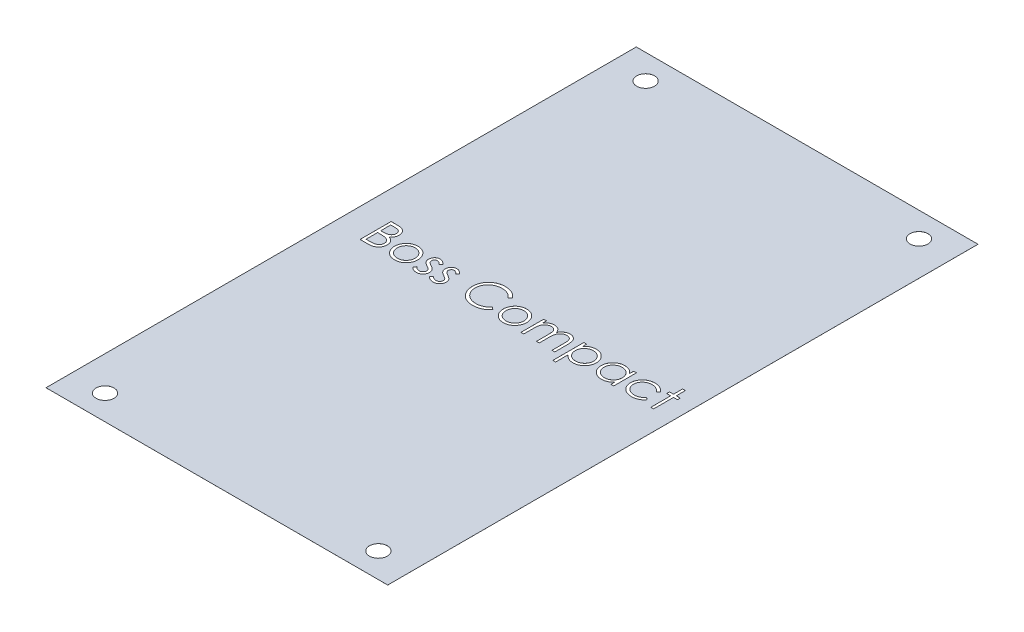
from build123d import *

# Parameters (mm, degrees)
SKETCH2_W           = 69.85
SKETCH2_H           = 120.65
BOSS_EXTRUDE1_DEPTH = 0.00254
SKETCH3_R           = 1.8288
CUT_EXTRUDE1_DEPTH  = 70.705532467
CUT_EXTRUDE2_DEPTH  = 2.54


with BuildPart() as part:
    # Sketch2 → Boss-Extrude1 (new body)
    with BuildSketch(Plane(origin=(0, 0, 0), x_dir=(1, 0, 0), z_dir=(0, 1, 0))):
        Rectangle(SKETCH2_W, SKETCH2_H)
    extrude(amount=BOSS_EXTRUDE1_DEPTH)

    # Sketch3 → Cut-Extrude1 (cut, through all)
    with BuildSketch(Plane(origin=(0, 0.00254, 0), x_dir=(1, 0, 0), z_dir=(0, 1, 0))):
        with Locations(Location((-27.94, 55.245, 0), (0, 0, 270))):
            Circle(SKETCH3_R)
        with Locations(Location((27.94, 55.245, 0), (0, 0, 270))):
            Circle(SKETCH3_R)
        with Locations(Location((27.94, -55.245, 0), (0, 0, 270))):
            Circle(SKETCH3_R)
        with Locations(Location((-27.94, -55.245, 0), (0, 0, 270))):
            Circle(SKETCH3_R)
    extrude(amount=-CUT_EXTRUDE1_DEPTH, mode=Mode.SUBTRACT)

    # Sketch5 → Cut-Extrude2 (cut)
    # profile 1 of 11: a face of its own
    with BuildSketch(Plane(origin=(0, 0.00254, 0), x_dir=(1, 0, 0), z_dir=(0, 1, 0))):
        with BuildLine():
            Line((-29.079721619, 4.369281251), (-27.840759279, 4.369281251))
            add(Edge.make_bspline(
                [(-27.840759279, 4.369281251), (-27.780110469, 4.36896239), (-27.66255798, 4.368344357), (-27.491616993, 4.358759248), (-27.331508436, 4.345689732), (-27.182185878, 4.324952278), (-27.043718318, 4.299930054), (-26.915688462, 4.269628188), (-26.798503435, 4.233294189), (-26.658598899, 4.175515936), (-26.4990857, 4.089658187), (-26.326368616, 3.962787791), (-26.178678067, 3.807607465), (-26.051340035, 3.632560361), (-25.95010086, 3.439999747), (-25.876859421, 3.234515219), (-25.830490133, 3.018757201), (-25.825721402, 2.87063315), (-25.823311363, 2.795773639)],
                knots=[0, 0, 0, 0, 1.001505555, 1.941167018, 2.826882275, 3.653841531, 4.429895133, 5.150066043, 5.825578002, 6.45369114, 7.647487171, 8.808567382, 9.977351308, 11.170798116, 12.373658725, 13.556498008, 14.765093433, 16, 16, 16, 16], degree=3))
            add(Edge.make_bspline(
                [(-25.823311363, 2.795773639), (-25.825294773, 2.725646859), (-25.829192362, 2.587841124), (-25.866462797, 2.386284669), (-25.924811438, 2.194421743), (-26.005919533, 2.012952558), (-26.111333155, 1.845977289), (-26.236261819, 1.692148963), (-26.386986875, 1.557980617), (-26.499913896, 1.482972779), (-26.557275706, 1.444872197)],
                knots=[0, 0, 0, 0, 1.044552857, 2.05264487, 3.044412934, 4.028983338, 5.005914585, 5.980388656, 6.974128949, 8, 8, 8, 8], degree=3))
            add(Edge.make_bspline(
                [(-26.557275706, 1.444872197), (-26.48513893, 1.417177127), (-26.347123408, 1.364189599), (-26.157193071, 1.270508114), (-25.993553852, 1.168613999), (-25.854947602, 1.0573405), (-25.736406428, 0.937400229), (-25.632896091, 0.807034522), (-25.544574169, 0.664542775), (-25.468895008, 0.511410647), (-25.409842265, 0.349201768), (-25.36561741, 0.179437646), (-25.340276466, 0.002727025), (-25.336670317, -0.117533592), (-25.334849824, -0.17824479)],
                knots=[0, 0, 0, 0, 1.27268992, 2.434971085, 3.483601985, 4.442670788, 5.356604649, 6.2567628, 7.179492994, 8.113709626, 9.066344395, 10.018646069, 10.999752585, 12, 12, 12, 12], degree=3))
            add(Edge.make_bspline(
                [(-25.334849824, -0.17824479), (-25.336622102, -0.240233258), (-25.340109108, -0.362197306), (-25.365835628, -0.541367336), (-25.409395008, -0.712590453), (-25.469395517, -0.876974142), (-25.547704287, -1.034200386), (-25.643005023, -1.184447307), (-25.756636574, -1.326205307), (-25.883750636, -1.461049595), (-26.027554814, -1.582294295), (-26.182704827, -1.690272791), (-26.351154579, -1.779074932), (-26.530137482, -1.853671143), (-26.721661313, -1.910652774), (-26.924866043, -1.950517301), (-27.139576419, -1.977377868), (-27.286914111, -1.979586226), (-27.362474023, -1.980718749)],
                knots=[0, 0, 0, 0, 0.978564426, 1.925352924, 2.850884081, 3.763762016, 4.682927383, 5.618979971, 6.567305752, 7.547517671, 8.540179244, 9.531824382, 10.526200242, 11.540722885, 12.589160233, 13.674978461, 14.80764778, 16, 16, 16, 16], degree=3))
            Line((-27.362474023, -1.980718749), (-29.079721619, -1.980718749))
            Line((-29.079721619, -1.980718749), (-29.079721619, 4.369281251))
        make_face()
        with BuildLine():
            Line((-28.509849824, 3.7179992), (-28.509849824, 1.68274279))
            Line((-28.509849824, 1.68274279), (-28.126967212, 1.68274279))
            add(Edge.make_bspline(
                [(-28.126967212, 1.68274279), (-28.070998683, 1.683468364), (-27.96285608, 1.684870322), (-27.806247125, 1.688886275), (-27.660877449, 1.700131296), (-27.52699798, 1.711373086), (-27.404819546, 1.729651267), (-27.294612826, 1.751408404), (-27.194648229, 1.774418817), (-27.079369339, 1.813552029), (-26.948608418, 1.87138724), (-26.809211215, 1.961143285), (-26.686321535, 2.068048898), (-26.582549494, 2.191403928), (-26.497620112, 2.32723258), (-26.438630943, 2.473367634), (-26.39863087, 2.626167017), (-26.395017663, 2.731065847), (-26.393183157, 2.784325322)],
                knots=[0, 0, 0, 0, 1.156816544, 2.235205308, 3.236616184, 4.169592532, 5.011045266, 5.787822928, 6.49130361, 7.128639758, 8.301311294, 9.436451833, 10.541879658, 11.654887649, 12.756523258, 13.837046038, 14.901820046, 16, 16, 16, 16], degree=3))
            add(Edge.make_bspline(
                [(-26.393183157, 2.784325322), (-26.394137799, 2.819569222), (-26.396010432, 2.888703979), (-26.411347138, 2.989486379), (-26.437414023, 3.084271473), (-26.470895383, 3.174358216), (-26.517683433, 3.256929716), (-26.572771431, 3.334840942), (-26.639329754, 3.405438643), (-26.71508945, 3.471423304), (-26.802190809, 3.52992409), (-26.900581867, 3.581160903), (-27.011593795, 3.62241917), (-27.133355689, 3.658552761), (-27.267741805, 3.683931522), (-27.413201352, 3.705074097), (-27.570925771, 3.715837786), (-27.680046171, 3.717262659), (-27.736452388, 3.7179992)],
                knots=[0, 0, 0, 0, 0.91205012, 1.789085906, 2.630437955, 3.453916878, 4.269457761, 5.079663411, 5.91843418, 6.774407191, 7.675494373, 8.627863946, 9.638891023, 10.736472738, 11.911756761, 13.175263542, 14.539845004, 16, 16, 16, 16], degree=3))
            Line((-27.736452388, 3.7179992), (-28.509849824, 3.7179992))
        make_face(mode=Mode.SUBTRACT)
        with BuildLine():
            Line((-28.509849824, 1.031460738), (-28.509849824, -1.329436697))
            Line((-28.509849824, -1.329436697), (-27.698291331, -1.329436697))
            add(Edge.make_bspline(
                [(-27.698291331, -1.329436697), (-27.640199851, -1.32874047), (-27.528236182, -1.327398583), (-27.366581093, -1.323017892), (-27.216751747, -1.313053334), (-27.079431844, -1.297367293), (-26.953138594, -1.280352106), (-26.839387047, -1.25747164), (-26.73725511, -1.231257097), (-26.618828866, -1.190736527), (-26.485472501, -1.127787216), (-26.341761376, -1.032874262), (-26.213988095, -0.919801975), (-26.105484267, -0.788935888), (-26.016560702, -0.646639052), (-25.951871519, -0.495789631), (-25.911973822, -0.338880175), (-25.907143887, -0.23189771), (-25.904721619, -0.17824479)],
                knots=[0, 0, 0, 0, 1.160039823, 2.235823828, 3.228722157, 4.157150951, 4.99529583, 5.772374946, 6.472645482, 7.099169577, 8.269452708, 9.405989375, 10.527446681, 11.663510218, 12.788923519, 13.866172445, 14.929861265, 16, 16, 16, 16], degree=3))
            add(Edge.make_bspline(
                [(-25.904721619, -0.17824479), (-25.905222551, -0.144692587), (-25.906216335, -0.07812938), (-25.921203451, 0.019689321), (-25.943000043, 0.114441976), (-25.971178502, 0.206385877), (-26.012216678, 0.293858717), (-26.060125695, 0.378590504), (-26.116298524, 0.460693245), (-26.203827225, 0.564492619), (-26.331139254, 0.684084914), (-26.512035832, 0.801174382), (-26.717725573, 0.895603975), (-26.866909739, 0.935698739), (-26.943974423, 0.956410658)],
                knots=[0, 0, 0, 0, 0.723448775, 1.435228256, 2.130040452, 2.821711965, 3.505591119, 4.210454504, 4.921174351, 5.648778258, 7.137944449, 8.670945889, 10.280296675, 12, 12, 12, 12], degree=3))
            add(Edge.make_bspline(
                [(-26.943974423, 0.956410658), (-26.974870069, 0.962679168), (-27.041858201, 0.976270589), (-27.151091954, 0.990617423), (-27.275798459, 1.003399174), (-27.416265679, 1.012853703), (-27.572671333, 1.022626432), (-27.745349457, 1.026427036), (-27.933594871, 1.030961408), (-28.064209604, 1.031290037), (-28.132055353, 1.031460738)],
                knots=[0, 0, 0, 0, 0.634451884, 1.375622551, 2.216452059, 3.157844607, 4.20941857, 5.370758133, 6.634282058, 8, 8, 8, 8], degree=3))
            Line((-28.132055353, 1.031460738), (-28.509849824, 1.031460738))
        make_face(mode=Mode.SUBTRACT)
    # profile 2 of 11: a face of its own
    with BuildSketch(Plane(origin=(0, 0.00254, 0), x_dir=(1, 0, 0), z_dir=(0, 1, 0))):
        with BuildLine():
            add(Edge.make_bspline(
                [(-21.953780113, 2.741076123), (-21.866710232, 2.739222121), (-21.695987475, 2.735586875), (-21.445964596, 2.696734008), (-21.207304135, 2.637320933), (-20.979092043, 2.555185385), (-20.76425105, 2.445090989), (-20.559651793, 2.313719846), (-20.36585522, 2.158085712), (-20.249699152, 2.037693217), (-20.190739247, 1.976582934)],
                knots=[0, 0, 0, 0, 1.054011418, 2.066658804, 3.057071809, 4.030435133, 4.997543892, 5.974964718, 6.972108034, 8, 8, 8, 8], degree=3))
            add(Edge.make_bspline(
                [(-20.190739247, 1.976582934), (-20.139971988, 1.91813756), (-20.039419955, 1.80237789), (-19.910486437, 1.61467985), (-19.799413035, 1.420297096), (-19.710398805, 1.216648374), (-19.64021312, 1.005511471), (-19.590382499, 0.786160679), (-19.560742631, 0.559080421), (-19.55674582, 0.404859172), (-19.554721619, 0.326753206)],
                knots=[0, 0, 0, 0, 1.025258237, 2.030674902, 3.01204498, 3.988269485, 4.97094183, 5.956517959, 6.965070386, 8, 8, 8, 8], degree=3))
            add(Edge.make_bspline(
                [(-19.554721619, 0.326753206), (-19.556502045, 0.24819453), (-19.560020251, 0.092958923), (-19.593300812, -0.135676212), (-19.645064353, -0.357372534), (-19.719144974, -0.571201878), (-19.814137544, -0.777817865), (-19.930053505, -0.976318047), (-20.067706296, -1.16709406), (-20.223742119, -1.348525967), (-20.39619338, -1.515741814), (-20.583275535, -1.661480246), (-20.781312139, -1.786342154), (-20.992936509, -1.886919651), (-21.216216092, -1.966221536), (-21.451632487, -2.021920137), (-21.698819972, -2.055596335), (-21.86759793, -2.059920818), (-21.953780113, -2.062129005)],
                knots=[0, 0, 0, 0, 0.998656419, 1.973391657, 2.932242238, 3.890759089, 4.846373663, 5.82037756, 6.809684879, 7.83454468, 8.860553229, 9.859544525, 10.845671541, 11.83227036, 12.833544569, 13.85385346, 14.904124723, 16, 16, 16, 16], degree=3))
            add(Edge.make_bspline(
                [(-21.953780113, -2.062129005), (-22.040384532, -2.059913406), (-22.210003663, -2.055574044), (-22.458063659, -2.022050974), (-22.693901968, -1.966247206), (-22.917473854, -1.88665904), (-23.130008076, -1.786338939), (-23.329192149, -1.661857731), (-23.516426282, -1.515698592), (-23.688914025, -1.348537678), (-23.844940066, -1.167091043), (-23.982595381, -0.97631883), (-24.098510687, -0.777817661), (-24.193503428, -0.571201932), (-24.267584003, -0.357372519), (-24.319347557, -0.135676216), (-24.352628115, 0.092958924), (-24.356146321, 0.248194531), (-24.357926747, 0.326753206)],
                knots=[0, 0, 0, 0, 1.099876186, 2.154163076, 3.173186993, 4.173200201, 5.163417411, 6.152872554, 7.150605724, 8.17532212, 9.198891216, 10.186952605, 11.159729845, 12.11414092, 13.071450619, 14.029093627, 15.002601286, 16, 16, 16, 16], degree=3))
            add(Edge.make_bspline(
                [(-24.357926747, 0.326753206), (-24.355888741, 0.404434654), (-24.35185384, 0.55823057), (-24.322243773, 0.784883951), (-24.272607535, 1.0038635), (-24.202337716, 1.214185435), (-24.112503012, 1.416941726), (-24.00299039, 1.611804777), (-23.872741671, 1.798654072), (-23.772589559, 1.914264131), (-23.721909119, 1.972766828)],
                knots=[0, 0, 0, 0, 1.031353054, 2.041901799, 3.029428768, 4.008703097, 4.981709435, 5.96992636, 6.972712378, 8, 8, 8, 8], degree=3))
            add(Edge.make_bspline(
                [(-23.721909119, 1.972766828), (-23.663038104, 2.034407075), (-23.547257894, 2.155633467), (-23.352496631, 2.310813903), (-23.148400698, 2.44491878), (-22.931185475, 2.552825628), (-22.703160861, 2.637804082), (-22.463277378, 2.696887231), (-22.212406086, 2.735446889), (-22.040847916, 2.739181012), (-21.953780113, 2.741076123)],
                knots=[0, 0, 0, 0, 1.027980169, 2.021703884, 2.998553061, 3.971491411, 4.943284454, 5.930300938, 6.949603206, 8, 8, 8, 8], degree=3))
        make_face()
        with BuildLine():
            add(Edge.make_bspline(
                [(-21.956324183, 2.171204328), (-22.017896706, 2.169454283), (-22.139452268, 2.165999371), (-22.318376372, 2.139721429), (-22.490624937, 2.0980881), (-22.656524754, 2.038935027), (-22.815516367, 1.962555596), (-22.967751997, 1.868741857), (-23.113679424, 1.75873635), (-23.250444025, 1.632711217), (-23.375960505, 1.495045041), (-23.485684834, 1.348363019), (-23.57898467, 1.195044362), (-23.656708958, 1.034929636), (-23.714597714, 0.866396257), (-23.756640198, 0.691352826), (-23.782893348, 0.509442713), (-23.786315778, 0.385779151), (-23.788054952, 0.322937101)],
                knots=[0, 0, 0, 0, 1.021534396, 2.016698045, 2.994645724, 3.958388632, 4.93408049, 5.916473867, 6.921342795, 7.962252576, 8.998418191, 10.008913653, 10.997312074, 11.973003931, 12.956656626, 13.948281152, 14.957379055, 16, 16, 16, 16], degree=3))
            add(Edge.make_bspline(
                [(-23.788054952, 0.322937101), (-23.785139715, 0.241744137), (-23.779353515, 0.080591287), (-23.732299586, -0.156737464), (-23.653584478, -0.384578824), (-23.547290413, -0.601597125), (-23.414110559, -0.802388258), (-23.25719831, -0.981406522), (-23.07823771, -1.135957923), (-22.87936206, -1.264193171), (-22.664633512, -1.366083014), (-22.437382758, -1.438289727), (-22.200363213, -1.485228369), (-22.038382458, -1.489893758), (-21.956324183, -1.49225721)],
                knots=[0, 0, 0, 0, 1.016792936, 2.018143844, 3.017858371, 4.030088057, 5.03801393, 6.028138512, 7.003788237, 7.991172063, 8.984598303, 9.972568034, 10.972917682, 12, 12, 12, 12], degree=3))
            add(Edge.make_bspline(
                [(-21.956324183, -1.49225721), (-21.874270628, -1.489879988), (-21.71229919, -1.485187416), (-21.475608969, -1.438526129), (-21.248979334, -1.36576663), (-21.034473817, -1.264307763), (-20.835688693, -1.135470954), (-20.655441002, -0.982279241), (-20.499868522, -0.801914111), (-20.36682041, -0.601331166), (-20.258785605, -0.38491527), (-20.180438939, -0.156695413), (-20.13327189, 0.080580578), (-20.127500958, 0.241740549), (-20.124593414, 0.322937101)],
                knots=[0, 0, 0, 0, 1.02726834, 2.027799167, 3.010890988, 4.004497153, 4.992059811, 5.971914811, 6.958719428, 7.966827853, 8.981595046, 9.981490638, 10.983022906, 12, 12, 12, 12], degree=3))
            add(Edge.make_bspline(
                [(-20.124593414, 0.322937101), (-20.126331989, 0.385779527), (-20.129753241, 0.509443828), (-20.156014962, 0.691348565), (-20.198025727, 0.86641189), (-20.256031375, 1.034871953), (-20.333417943, 1.195458925), (-20.428516982, 1.347912859), (-20.537793271, 1.495553164), (-20.664824333, 1.632266198), (-20.801446176, 1.758785478), (-20.947432745, 1.868784513), (-21.099442635, 1.962143294), (-21.257972349, 2.03958833), (-21.423893436, 2.097549933), (-21.595900656, 2.139961822), (-21.774061354, 2.165888322), (-21.895181333, 2.169420993), (-21.956324183, 2.171204328)],
                knots=[0, 0, 0, 0, 1.042956736, 2.052379634, 3.044323526, 4.02829302, 5.004299113, 5.996692471, 7.007513377, 8.048758398, 9.090003419, 10.095195979, 11.07790575, 12.047570684, 13.018257071, 13.989683339, 14.985167495, 16, 16, 16, 16], degree=3))
        make_face(mode=Mode.SUBTRACT)
    # profile 3 of 11: a face of its own
    with BuildSketch(Plane(origin=(0, 0.00254, 0), x_dir=(1, 0, 0), z_dir=(0, 1, 0))):
        with BuildLine():
            Line((-16.216901106, 2.080889825), (-16.603599824, 1.68274279))
            add(Edge.make_bspline(
                [(-16.603599824, 1.68274279), (-16.636965452, 1.721410927), (-16.701290454, 1.795958542), (-16.803310427, 1.895630077), (-16.904953251, 1.979335667), (-17.004827527, 2.050006193), (-17.105444672, 2.103435359), (-17.205623938, 2.14243318), (-17.305469049, 2.166566456), (-17.372209427, 2.169676938), (-17.404982036, 2.171204328)],
                knots=[0, 0, 0, 0, 1.26578478, 2.440284043, 3.530471711, 4.527705817, 5.468200915, 6.346673037, 7.188140097, 8, 8, 8, 8], degree=3))
            add(Edge.make_bspline(
                [(-17.404982036, 2.171204328), (-17.445149214, 2.169254201), (-17.524192537, 2.165416628), (-17.637450808, 2.127110833), (-17.742589799, 2.068312122), (-17.833588891, 1.984911977), (-17.910673682, 1.889182518), (-17.966941361, 1.782146329), (-18.001351074, 1.66703345), (-18.005713945, 1.587150708), (-18.007926747, 1.546635017)],
                knots=[0, 0, 0, 0, 0.99966794, 1.967205029, 2.953328237, 3.988086729, 5.028030931, 6.008226631, 6.989793394, 8, 8, 8, 8], degree=3))
            add(Edge.make_bspline(
                [(-18.007926747, 1.546635017), (-18.005911416, 1.509964594), (-18.001886436, 1.436727122), (-17.970596032, 1.328689975), (-17.92076473, 1.22335792), (-17.874191663, 1.158836647), (-17.850194375, 1.125591347)],
                knots=[0, 0, 0, 0, 0.960159726, 1.917612774, 2.927026955, 4, 4, 4, 4], degree=3))
            add(Edge.make_bspline(
                [(-17.850194375, 1.125591347), (-17.835746322, 1.107839316), (-17.804995463, 1.070056354), (-17.747285728, 1.017616506), (-17.681930616, 0.959664136), (-17.603335872, 0.901721589), (-17.514887578, 0.84070403), (-17.414667734, 0.779014446), (-17.305856847, 0.711950418), (-17.227956305, 0.669415514), (-17.187464007, 0.647306091)],
                knots=[0, 0, 0, 0, 0.66740084, 1.420478572, 2.27185888, 3.217733974, 4.268547843, 5.408967954, 6.65319498, 8, 8, 8, 8], degree=3))
            add(Edge.make_bspline(
                [(-17.187464007, 0.647306091), (-17.138090803, 0.619647482), (-17.04271803, 0.566220156), (-16.907204009, 0.483289694), (-16.784218949, 0.40086411), (-16.672720809, 0.319824913), (-16.574854956, 0.23790471), (-16.487652125, 0.158243494), (-16.413287377, 0.07843432), (-16.371642395, 0.022675671), (-16.351736843, -0.00397596)],
                knots=[0, 0, 0, 0, 1.27191281, 2.456916733, 3.569705269, 4.599008579, 5.553216877, 6.436649441, 7.252746552, 8, 8, 8, 8], degree=3))
            add(Edge.make_bspline(
                [(-16.351736843, -0.00397596), (-16.318697744, -0.05779872), (-16.252943803, -0.164916001), (-16.183895234, -0.341298005), (-16.143871593, -0.528369917), (-16.13831585, -0.656335516), (-16.13549085, -0.721403845)],
                knots=[0, 0, 0, 0, 0.995354457, 1.980940102, 2.973342416, 4, 4, 4, 4], degree=3))
            add(Edge.make_bspline(
                [(-16.13549085, -0.721403845), (-16.13679629, -0.767249296), (-16.139368802, -0.857592765), (-16.157254152, -0.990643099), (-16.188015323, -1.117887225), (-16.229913991, -1.240705813), (-16.286491353, -1.356745604), (-16.352799499, -1.468934227), (-16.432401125, -1.574844844), (-16.523281192, -1.674338386), (-16.622786588, -1.765208242), (-16.728933439, -1.845080273), (-16.841852461, -1.91143657), (-16.9607368, -1.966346554), (-17.085856573, -2.01001325), (-17.21723134, -2.040243843), (-17.354443509, -2.058337281), (-17.447751876, -2.060849116), (-17.495296539, -2.062129005)],
                knots=[0, 0, 0, 0, 1.032770009, 2.035186124, 3.017557409, 3.978232242, 4.952395191, 5.920591857, 6.910227898, 7.931268572, 8.952309245, 9.941945286, 10.918353717, 11.897095711, 12.887975737, 13.898235213, 14.929059601, 16, 16, 16, 16], degree=3))
            add(Edge.make_bspline(
                [(-17.495296539, -2.062129005), (-17.5594627, -2.060327963), (-17.686903439, -2.056750904), (-17.875389072, -2.023175622), (-18.059576734, -1.97093255), (-18.238072586, -1.898876498), (-18.406884821, -1.807888776), (-18.561336642, -1.698918434), (-18.701964581, -1.575565153), (-18.782007734, -1.481017443), (-18.822029311, -1.433743588)],
                knots=[0, 0, 0, 0, 1.013940152, 2.01379169, 3.017749504, 4.037548394, 5.051665909, 6.043208538, 7.021604269, 8, 8, 8, 8], degree=3))
            Line((-18.822029311, -1.433743588), (-18.44423484, -1.003795672))
            add(Edge.make_bspline(
                [(-18.44423484, -1.003795672), (-18.408362034, -1.042539316), (-18.338817174, -1.117649729), (-18.227599253, -1.217661032), (-18.114425196, -1.301483339), (-18.000425122, -1.371593534), (-17.883911522, -1.425614623), (-17.765537337, -1.463566929), (-17.645543339, -1.487958534), (-17.564948892, -1.49082199), (-17.52455335, -1.49225721)],
                knots=[0, 0, 0, 0, 1.179806542, 2.287233372, 3.337373186, 4.324005949, 5.273901747, 6.200048787, 7.097828587, 8, 8, 8, 8], degree=3))
            add(Edge.make_bspline(
                [(-17.52455335, -1.49225721), (-17.46954797, -1.489770142), (-17.362076684, -1.484910829), (-17.208145865, -1.440792676), (-17.066017214, -1.371614049), (-16.94260343, -1.273488954), (-16.837552367, -1.159269558), (-16.761482679, -1.030611084), (-16.713810189, -0.891289441), (-16.708211306, -0.794710835), (-16.705362645, -0.745572515)],
                knots=[0, 0, 0, 0, 1.072336372, 2.095165389, 3.102688358, 4.141489647, 5.156069229, 6.117746104, 7.042326257, 8, 8, 8, 8], degree=3))
            add(Edge.make_bspline(
                [(-16.705362645, -0.745572515), (-16.707333493, -0.705096492), (-16.711224669, -0.625182004), (-16.741783177, -0.509520671), (-16.790066495, -0.399812119), (-16.837609214, -0.335605188), (-16.861822981, -0.302904246)],
                knots=[0, 0, 0, 0, 1.013901739, 2.00181326, 2.98231254, 4, 4, 4, 4], degree=3))
            add(Edge.make_bspline(
                [(-16.861822981, -0.302904246), (-16.876377897, -0.286511517), (-16.90808376, -0.250802234), (-16.966241126, -0.199231019), (-17.03587679, -0.143644754), (-17.117773943, -0.084986014), (-17.212097681, -0.024028544), (-17.319230301, 0.038907852), (-17.43770416, 0.10681244), (-17.521470877, 0.151842386), (-17.565258478, 0.175381011)],
                knots=[0, 0, 0, 0, 0.615000592, 1.339693406, 2.178160186, 3.116406724, 4.166410947, 5.330106347, 6.604359322, 8, 8, 8, 8], degree=3))
            add(Edge.make_bspline(
                [(-17.565258478, 0.175381011), (-17.612514525, 0.20175915), (-17.704159081, 0.252914779), (-17.833966309, 0.332591096), (-17.951073652, 0.413630295), (-18.05829898, 0.491486446), (-18.152933947, 0.570264444), (-18.234605739, 0.650051743), (-18.306529859, 0.727630575), (-18.346348735, 0.782598528), (-18.365368654, 0.808854569)],
                knots=[0, 0, 0, 0, 1.262093308, 2.447601706, 3.550203992, 4.582594899, 5.537233252, 6.418365656, 7.244515135, 8, 8, 8, 8], degree=3))
            add(Edge.make_bspline(
                [(-18.365368654, 0.808854569), (-18.398262742, 0.861733042), (-18.464062413, 0.967508466), (-18.527952831, 1.144057474), (-18.571869484, 1.329922078), (-18.575792677, 1.458168228), (-18.577798542, 1.523738383)],
                knots=[0, 0, 0, 0, 0.985009483, 1.970363186, 2.962279964, 4, 4, 4, 4], degree=3))
            add(Edge.make_bspline(
                [(-18.577798542, 1.523738383), (-18.576829359, 1.566601605), (-18.574932531, 1.650491003), (-18.559794037, 1.773751434), (-18.532231933, 1.890860227), (-18.497660859, 2.003576107), (-18.449613122, 2.109715621), (-18.392198408, 2.210694175), (-18.324729795, 2.306372198), (-18.246999824, 2.395277881), (-18.161534911, 2.476030516), (-18.069197257, 2.546422312), (-17.972063563, 2.606486699), (-17.869722573, 2.656860633), (-17.761191144, 2.694963141), (-17.6472279, 2.721192968), (-17.528063519, 2.738710265), (-17.446600047, 2.740276146), (-17.404982036, 2.741076123)],
                knots=[0, 0, 0, 0, 1.087655834, 2.128696564, 3.144119009, 4.137814668, 5.115653402, 6.093965665, 7.082169637, 8.081268856, 9.086088321, 10.061021666, 11.022561449, 11.980240094, 12.950172527, 13.934149372, 14.944599409, 16, 16, 16, 16], degree=3))
            add(Edge.make_bspline(
                [(-17.404982036, 2.741076123), (-17.355647863, 2.739072533), (-17.256054061, 2.735027769), (-17.106639239, 2.702904588), (-16.957444462, 2.650048813), (-16.808086384, 2.57704879), (-16.659659144, 2.482584601), (-16.510857133, 2.368412872), (-16.359893992, 2.235284733), (-16.265630396, 2.133504709), (-16.216901106, 2.080889825)],
                knots=[0, 0, 0, 0, 0.845714091, 1.707292901, 2.609013841, 3.555613372, 4.552488639, 5.621697636, 6.770543573, 8, 8, 8, 8], degree=3))
        make_face()
    # profile 4 of 11: a face of its own
    with BuildSketch(Plane(origin=(0, 0.00254, 0), x_dir=(1, 0, 0), z_dir=(0, 1, 0))):
        with BuildLine():
            Line((-12.797670337, 2.080889825), (-13.184369055, 1.68274279))
            add(Edge.make_bspline(
                [(-13.184369055, 1.68274279), (-13.217734683, 1.721410927), (-13.282059685, 1.795958542), (-13.384079658, 1.895630077), (-13.485722482, 1.979335667), (-13.585596758, 2.050006193), (-13.686213903, 2.103435359), (-13.786393169, 2.14243318), (-13.88623828, 2.166566456), (-13.952978658, 2.169676938), (-13.985751266, 2.171204328)],
                knots=[0, 0, 0, 0, 1.26578478, 2.440284043, 3.530471711, 4.527705817, 5.468200915, 6.346673037, 7.188140097, 8, 8, 8, 8], degree=3))
            add(Edge.make_bspline(
                [(-13.985751266, 2.171204328), (-14.025918445, 2.169254201), (-14.104961768, 2.165416628), (-14.218220039, 2.127110833), (-14.32335903, 2.068312122), (-14.414358122, 1.984911977), (-14.491442913, 1.889182518), (-14.547710591, 1.782146329), (-14.582120304, 1.66703345), (-14.586483175, 1.587150708), (-14.588695978, 1.546635017)],
                knots=[0, 0, 0, 0, 0.99966794, 1.967205029, 2.953328237, 3.988086729, 5.028030931, 6.008226631, 6.989793394, 8, 8, 8, 8], degree=3))
            add(Edge.make_bspline(
                [(-14.588695978, 1.546635017), (-14.586680647, 1.509964594), (-14.582655667, 1.436727122), (-14.551365263, 1.328689975), (-14.501533961, 1.22335792), (-14.454960894, 1.158836647), (-14.430963606, 1.125591347)],
                knots=[0, 0, 0, 0, 0.960159726, 1.917612774, 2.927026955, 4, 4, 4, 4], degree=3))
            add(Edge.make_bspline(
                [(-14.430963606, 1.125591347), (-14.416515553, 1.107839316), (-14.385764693, 1.070056354), (-14.328054959, 1.017616506), (-14.262699847, 0.959664136), (-14.184105103, 0.901721589), (-14.095656809, 0.84070403), (-13.995436965, 0.779014446), (-13.886626077, 0.711950418), (-13.808725535, 0.669415514), (-13.768233238, 0.647306091)],
                knots=[0, 0, 0, 0, 0.66740084, 1.420478572, 2.27185888, 3.217733974, 4.268547843, 5.408967954, 6.65319498, 8, 8, 8, 8], degree=3))
            add(Edge.make_bspline(
                [(-13.768233238, 0.647306091), (-13.718860033, 0.619647482), (-13.623487261, 0.566220156), (-13.48797324, 0.483289694), (-13.36498818, 0.40086411), (-13.25349004, 0.319824913), (-13.155624187, 0.23790471), (-13.068421356, 0.158243494), (-12.994056607, 0.07843432), (-12.952411626, 0.022675671), (-12.932506074, -0.00397596)],
                knots=[0, 0, 0, 0, 1.27191281, 2.456916733, 3.569705269, 4.599008579, 5.553216877, 6.436649441, 7.252746552, 8, 8, 8, 8], degree=3))
            add(Edge.make_bspline(
                [(-12.932506074, -0.00397596), (-12.899466974, -0.05779872), (-12.833713034, -0.164916001), (-12.764664465, -0.341298005), (-12.724640823, -0.528369917), (-12.719085081, -0.656335516), (-12.716260081, -0.721403845)],
                knots=[0, 0, 0, 0, 0.995354457, 1.980940102, 2.973342416, 4, 4, 4, 4], degree=3))
            add(Edge.make_bspline(
                [(-12.716260081, -0.721403845), (-12.71756552, -0.767249296), (-12.720138032, -0.857592765), (-12.738023382, -0.990643099), (-12.768784554, -1.117887225), (-12.810683222, -1.240705813), (-12.867260584, -1.356745604), (-12.93356873, -1.468934227), (-13.013170356, -1.574844844), (-13.104050423, -1.674338386), (-13.203555819, -1.765208242), (-13.30970267, -1.845080273), (-13.422621691, -1.91143657), (-13.541506031, -1.966346554), (-13.666625804, -2.01001325), (-13.798000571, -2.040243843), (-13.93521274, -2.058337281), (-14.028521106, -2.060849116), (-14.07606577, -2.062129005)],
                knots=[0, 0, 0, 0, 1.032770009, 2.035186124, 3.017557409, 3.978232242, 4.952395191, 5.920591857, 6.910227898, 7.931268572, 8.952309245, 9.941945286, 10.918353717, 11.897095711, 12.887975737, 13.898235213, 14.929059601, 16, 16, 16, 16], degree=3))
            add(Edge.make_bspline(
                [(-14.07606577, -2.062129005), (-14.140231931, -2.060327963), (-14.26767267, -2.056750904), (-14.456158303, -2.023175622), (-14.640345965, -1.97093255), (-14.818841817, -1.898876498), (-14.987654052, -1.807888776), (-15.142105872, -1.698918434), (-15.282733811, -1.575565153), (-15.362776965, -1.481017443), (-15.402798542, -1.433743588)],
                knots=[0, 0, 0, 0, 1.013940152, 2.01379169, 3.017749504, 4.037548394, 5.051665909, 6.043208538, 7.021604269, 8, 8, 8, 8], degree=3))
            Line((-15.402798542, -1.433743588), (-15.025004071, -1.003795672))
            add(Edge.make_bspline(
                [(-15.025004071, -1.003795672), (-14.989131265, -1.042539316), (-14.919586405, -1.117649729), (-14.808368483, -1.217661032), (-14.695194427, -1.301483339), (-14.581194353, -1.371593534), (-14.464680753, -1.425614623), (-14.346306567, -1.463566929), (-14.226312569, -1.487958534), (-14.145718123, -1.49082199), (-14.105322581, -1.49225721)],
                knots=[0, 0, 0, 0, 1.179806542, 2.287233372, 3.337373186, 4.324005949, 5.273901747, 6.200048787, 7.097828587, 8, 8, 8, 8], degree=3))
            add(Edge.make_bspline(
                [(-14.105322581, -1.49225721), (-14.050317201, -1.489770142), (-13.942845915, -1.484910829), (-13.788915096, -1.440792676), (-13.646786445, -1.371614049), (-13.523372661, -1.273488954), (-13.418321597, -1.159269558), (-13.34225191, -1.030611084), (-13.29457942, -0.891289441), (-13.288980537, -0.794710835), (-13.286131875, -0.745572515)],
                knots=[0, 0, 0, 0, 1.072336372, 2.095165389, 3.102688358, 4.141489647, 5.156069229, 6.117746104, 7.042326257, 8, 8, 8, 8], degree=3))
            add(Edge.make_bspline(
                [(-13.286131875, -0.745572515), (-13.288102724, -0.705096492), (-13.2919939, -0.625182004), (-13.322552408, -0.509520671), (-13.370835725, -0.399812119), (-13.418378444, -0.335605188), (-13.442592212, -0.302904246)],
                knots=[0, 0, 0, 0, 1.013901739, 2.00181326, 2.98231254, 4, 4, 4, 4], degree=3))
            add(Edge.make_bspline(
                [(-13.442592212, -0.302904246), (-13.457147128, -0.286511517), (-13.48885299, -0.250802234), (-13.547010357, -0.199231019), (-13.616646021, -0.143644754), (-13.698543174, -0.084986014), (-13.792866912, -0.024028544), (-13.899999531, 0.038907852), (-14.018473391, 0.10681244), (-14.102240108, 0.151842386), (-14.146027709, 0.175381011)],
                knots=[0, 0, 0, 0, 0.615000592, 1.339693406, 2.178160186, 3.116406724, 4.166410947, 5.330106347, 6.604359322, 8, 8, 8, 8], degree=3))
            add(Edge.make_bspline(
                [(-14.146027709, 0.175381011), (-14.193283756, 0.20175915), (-14.284928312, 0.252914779), (-14.41473554, 0.332591096), (-14.531842882, 0.413630295), (-14.63906821, 0.491486446), (-14.733703178, 0.570264444), (-14.81537497, 0.650051743), (-14.88729909, 0.727630575), (-14.927117966, 0.782598528), (-14.946137885, 0.808854569)],
                knots=[0, 0, 0, 0, 1.262093308, 2.447601706, 3.550203992, 4.582594899, 5.537233252, 6.418365656, 7.244515135, 8, 8, 8, 8], degree=3))
            add(Edge.make_bspline(
                [(-14.946137885, 0.808854569), (-14.979031973, 0.861733042), (-15.044831644, 0.967508466), (-15.108722062, 1.144057474), (-15.152638715, 1.329922078), (-15.156561908, 1.458168228), (-15.158567773, 1.523738383)],
                knots=[0, 0, 0, 0, 0.985009483, 1.970363186, 2.962279964, 4, 4, 4, 4], degree=3))
            add(Edge.make_bspline(
                [(-15.158567773, 1.523738383), (-15.15759859, 1.566601605), (-15.155701762, 1.650491003), (-15.140563268, 1.773751434), (-15.113001163, 1.890860227), (-15.07843009, 2.003576107), (-15.030382353, 2.109715621), (-14.972967639, 2.210694175), (-14.905499025, 2.306372198), (-14.827769055, 2.395277881), (-14.742304141, 2.476030516), (-14.649966488, 2.546422312), (-14.552832794, 2.606486699), (-14.450491804, 2.656860633), (-14.341960374, 2.694963141), (-14.227997131, 2.721192968), (-14.10883275, 2.738710265), (-14.027369278, 2.740276146), (-13.985751266, 2.741076123)],
                knots=[0, 0, 0, 0, 1.087655834, 2.128696564, 3.144119009, 4.137814668, 5.115653402, 6.093965665, 7.082169637, 8.081268856, 9.086088321, 10.061021666, 11.022561449, 11.980240094, 12.950172527, 13.934149372, 14.944599409, 16, 16, 16, 16], degree=3))
            add(Edge.make_bspline(
                [(-13.985751266, 2.741076123), (-13.936417094, 2.739072533), (-13.836823292, 2.735027769), (-13.68740847, 2.702904588), (-13.538213692, 2.650048813), (-13.388855615, 2.57704879), (-13.240428375, 2.482584601), (-13.091626364, 2.368412872), (-12.940663223, 2.235284733), (-12.846399627, 2.133504709), (-12.797670337, 2.080889825)],
                knots=[0, 0, 0, 0, 0.845714091, 1.707292901, 2.609013841, 3.555613372, 4.552488639, 5.621697636, 6.770543573, 8, 8, 8, 8], degree=3))
        make_face()
    # profile 5 of 11: a face of its own
    with BuildSketch(Plane(origin=(0, 0.00254, 0), x_dir=(1, 0, 0), z_dir=(0, 1, 0))):
        with BuildLine():
            Line((-3.109849824, 3.204096956), (-3.608487645, 2.822486379))
            add(Edge.make_bspline(
                [(-3.608487645, 2.822486379), (-3.644058328, 2.864878925), (-3.714720124, 2.949092472), (-3.82840182, 3.067346788), (-3.946877658, 3.17813662), (-4.070102349, 3.281989744), (-4.200293895, 3.375274448), (-4.334298487, 3.46285202), (-4.474357797, 3.541352059), (-4.668035944, 3.636534905), (-4.92139704, 3.735860072), (-5.240339106, 3.819141649), (-5.57328067, 3.872157211), (-5.800424886, 3.877899137), (-5.9159596, 3.880819713)],
                knots=[0, 0, 0, 0, 0.757959112, 1.505699292, 2.245454638, 2.979532153, 3.711538275, 4.438200793, 5.171680507, 5.909471876, 7.393775596, 8.890124382, 10.418191784, 12, 12, 12, 12], degree=3))
            add(Edge.make_bspline(
                [(-5.9159596, 3.880819713), (-5.979610729, 3.880086809), (-6.106322244, 3.878627805), (-6.294370188, 3.85937982), (-6.478906724, 3.832326625), (-6.659811813, 3.792184967), (-6.83685518, 3.741434644), (-7.011194253, 3.680791393), (-7.180304912, 3.605761898), (-7.346526573, 3.522834055), (-7.505783142, 3.429167119), (-7.656468728, 3.326998609), (-7.798033756, 3.21747182), (-7.930590209, 3.100176241), (-8.054273601, 2.975640113), (-8.168187722, 2.842536236), (-8.271938395, 2.70129015), (-8.367582141, 2.553764396), (-8.453239528, 2.400388689), (-8.524958024, 2.240595347), (-8.588467317, 2.07712076), (-8.638721657, 1.908117939), (-8.678498995, 1.734776064), (-8.705944898, 1.55662992), (-8.724973982, 1.374051673), (-8.726425731, 1.250300491), (-8.727157516, 1.187921075)],
                knots=[0, 0, 0, 0, 1.054917814, 2.100044995, 3.131103042, 4.146048494, 5.169673617, 6.183595914, 7.203665975, 8.234915748, 9.262203917, 10.264457458, 11.251630812, 12.227803204, 13.197192746, 14.159520551, 15.12972552, 16.100847026, 17.073214652, 18.039054194, 19.002613845, 19.979014051, 20.95965708, 21.949030935, 22.966165397, 24, 24, 24, 24], degree=3))
            add(Edge.make_bspline(
                [(-8.727157516, 1.187921075), (-8.724868216, 1.09406568), (-8.720373479, 0.909793062), (-8.680371501, 0.639880669), (-8.619583693, 0.381307446), (-8.528478289, 0.135689732), (-8.41613944, -0.100001146), (-8.274188616, -0.321777351), (-8.109784327, -0.532990261), (-7.920600738, -0.728648181), (-7.7130359, -0.907380225), (-7.490336117, -1.064770566), (-7.253056053, -1.195970424), (-7.003815595, -1.305146784), (-6.740696788, -1.389069704), (-6.46417279, -1.448150329), (-6.174845027, -1.486689713), (-5.977143401, -1.490379404), (-5.876526507, -1.49225721)],
                knots=[0, 0, 0, 0, 1.029171465, 2.020641659, 2.987623507, 3.938342917, 4.889210282, 5.84687017, 6.821220943, 7.821438502, 8.827599549, 9.822697543, 10.807740252, 11.797342354, 12.80366471, 13.83203677, 14.896651826, 16, 16, 16, 16], degree=3))
            add(Edge.make_bspline(
                [(-5.876526507, -1.49225721), (-5.765668771, -1.489193281), (-5.547474228, -1.483162736), (-5.227492237, -1.432073813), (-4.921175919, -1.349237305), (-4.628508798, -1.233308217), (-4.35031594, -1.082604052), (-4.086161999, -0.899909331), (-3.835824007, -0.683486213), (-3.685290395, -0.518235395), (-3.608487645, -0.433923877)],
                knots=[0, 0, 0, 0, 1.028121516, 2.023589091, 2.998037872, 3.967518031, 4.937445131, 5.927275754, 6.942489185, 8, 8, 8, 8], degree=3))
            Line((-3.608487645, -0.433923877), (-3.109849824, -0.811718348))
            add(Edge.make_bspline(
                [(-3.109849824, -0.811718348), (-3.149978395, -0.863495254), (-3.230043323, -0.966801057), (-3.359688582, -1.112436873), (-3.496263108, -1.249422766), (-3.640781324, -1.376654307), (-3.791580746, -1.496677409), (-3.951369084, -1.60608216), (-4.118045758, -1.706395622), (-4.291046026, -1.798247327), (-4.470186081, -1.879740047), (-4.65525127, -1.949506169), (-4.845443886, -2.009604182), (-5.040772622, -2.059046982), (-5.241642638, -2.097638806), (-5.44732907, -2.123437358), (-5.658275844, -2.141111975), (-5.800590993, -2.142722908), (-5.872710401, -2.143539262)],
                knots=[0, 0, 0, 0, 0.986787822, 1.968848986, 2.935600012, 3.899624008, 4.868462664, 5.837806735, 6.815139263, 7.798259679, 8.787526145, 9.778297419, 10.776456485, 11.791383307, 12.812564526, 13.85620153, 14.913611965, 16, 16, 16, 16], degree=3))
            add(Edge.make_bspline(
                [(-5.872710401, -2.143539262), (-5.941006768, -2.143063932), (-6.076054378, -2.142124027), (-6.275442113, -2.126898238), (-6.469551781, -2.106125144), (-6.657828602, -2.07484662), (-6.841300014, -2.037936175), (-7.018302788, -1.988458323), (-7.19057867, -1.933033407), (-7.357435517, -1.867891502), (-7.519015258, -1.794383571), (-7.674796744, -1.7113046), (-7.824708329, -1.619353217), (-7.970223878, -1.52055627), (-8.10919378, -1.411740308), (-8.242822319, -1.294416556), (-8.371858811, -1.168980451), (-8.451692254, -1.078529503), (-8.491830994, -1.033052483)],
                knots=[0, 0, 0, 0, 1.114604814, 2.203992996, 3.262667896, 4.300477797, 5.318619304, 6.316056647, 7.298880507, 8.271930387, 9.238335007, 10.195173496, 11.151986948, 12.108099108, 13.064862484, 14.031167946, 15.010108607, 16, 16, 16, 16], degree=3))
            add(Edge.make_bspline(
                [(-8.491830994, -1.033052483), (-8.556121376, -0.954056326), (-8.683925969, -0.797017723), (-8.84743971, -0.542498871), (-8.987407417, -0.276763692), (-9.100575159, 0.001583893), (-9.189044689, 0.291919296), (-9.250333429, 0.594388872), (-9.290159911, 0.908710138), (-9.294714292, 1.122499741), (-9.297029311, 1.231170274)],
                knots=[0, 0, 0, 0, 0.994628077, 1.977248131, 2.950237994, 3.925870899, 4.908910175, 5.911660606, 6.938484602, 8, 8, 8, 8], degree=3))
            add(Edge.make_bspline(
                [(-9.297029311, 1.231170274), (-9.294207746, 1.345389454), (-9.288656492, 1.57010856), (-9.241492692, 1.899898446), (-9.165621447, 2.215858841), (-9.057858521, 2.517399921), (-8.921233098, 2.806107715), (-8.752456241, 3.079776758), (-8.553488712, 3.340157237), (-8.325890982, 3.583298286), (-8.07630453, 3.805619683), (-7.809026111, 4.001210939), (-7.524578864, 4.163984146), (-7.226096476, 4.300048612), (-6.911343883, 4.404632138), (-6.580992627, 4.477844348), (-6.235663453, 4.523413974), (-6.000055909, 4.529174708), (-5.880342613, 4.532101764)],
                knots=[0, 0, 0, 0, 1.032925535, 2.032216505, 3.007276963, 3.968222605, 4.92396291, 5.891752235, 6.871517503, 7.883894988, 8.900124299, 9.891468569, 10.874487609, 11.85992873, 12.854644235, 13.869047385, 14.917252991, 16, 16, 16, 16], degree=3))
            add(Edge.make_bspline(
                [(-5.880342613, 4.532101764), (-5.807382071, 4.531227028), (-5.662964026, 4.529495575), (-5.44932707, 4.512611574), (-5.241333134, 4.48446546), (-5.038838924, 4.446154876), (-4.84085932, 4.398607307), (-4.648907455, 4.336667052), (-4.46185698, 4.265843631), (-4.28088759, 4.184276128), (-4.106867563, 4.09271504), (-3.939851099, 3.992175266), (-3.781164856, 3.882781448), (-3.629692231, 3.765463972), (-3.487967105, 3.637740872), (-3.351965565, 3.503125233), (-3.226306181, 3.357739581), (-3.14873967, 3.255404915), (-3.109849824, 3.204096956)],
                knots=[0, 0, 0, 0, 1.096760587, 2.17092713, 3.219439832, 4.250915756, 5.268269357, 6.278326846, 7.281116186, 8.274029601, 9.260640565, 10.235837813, 11.203064059, 12.156899882, 13.114053108, 14.069676657, 15.032185724, 16, 16, 16, 16], degree=3))
        make_face()
    # profile 6 of 11: a face of its own
    with BuildSketch(Plane(origin=(0, 0.00254, 0), x_dir=(1, 0, 0), z_dir=(0, 1, 0))):
        with BuildLine():
            add(Edge.make_bspline(
                [(0.271219887, 2.741076123), (0.358289768, 2.739222121), (0.529012525, 2.735586875), (0.779035404, 2.696734008), (1.017695865, 2.637320933), (1.245907957, 2.555185385), (1.46074895, 2.445090989), (1.665348207, 2.313719846), (1.85914478, 2.158085712), (1.975300848, 2.037693217), (2.034260753, 1.976582934)],
                knots=[0, 0, 0, 0, 1.054011418, 2.066658804, 3.057071809, 4.030435133, 4.997543892, 5.974964718, 6.972108034, 8, 8, 8, 8], degree=3))
            add(Edge.make_bspline(
                [(2.034260753, 1.976582934), (2.085028012, 1.91813756), (2.185580045, 1.80237789), (2.314513563, 1.61467985), (2.425586965, 1.420297096), (2.514601195, 1.216648374), (2.58478688, 1.005511471), (2.634617501, 0.786160679), (2.664257369, 0.559080421), (2.66825418, 0.404859172), (2.670278381, 0.326753206)],
                knots=[0, 0, 0, 0, 1.025258237, 2.030674902, 3.01204498, 3.988269485, 4.97094183, 5.956517959, 6.965070386, 8, 8, 8, 8], degree=3))
            add(Edge.make_bspline(
                [(2.670278381, 0.326753206), (2.668497955, 0.24819453), (2.664979749, 0.092958923), (2.631699188, -0.135676212), (2.579935647, -0.357372534), (2.505855026, -0.571201878), (2.410862456, -0.777817865), (2.294946495, -0.976318047), (2.157293704, -1.16709406), (2.001257881, -1.348525967), (1.82880662, -1.515741814), (1.641724465, -1.661480246), (1.443687861, -1.786342154), (1.232063491, -1.886919651), (1.008783908, -1.966221536), (0.773367513, -2.021920137), (0.526180028, -2.055596335), (0.35740207, -2.059920818), (0.271219887, -2.062129005)],
                knots=[0, 0, 0, 0, 0.998656419, 1.973391657, 2.932242238, 3.890759089, 4.846373663, 5.82037756, 6.809684879, 7.83454468, 8.860553229, 9.859544525, 10.845671541, 11.83227036, 12.833544569, 13.85385346, 14.904124723, 16, 16, 16, 16], degree=3))
            add(Edge.make_bspline(
                [(0.271219887, -2.062129005), (0.184615468, -2.059913406), (0.014996337, -2.055574044), (-0.233063659, -2.022050974), (-0.468901968, -1.966247206), (-0.692473854, -1.88665904), (-0.905008076, -1.786338939), (-1.104192149, -1.661857731), (-1.291426282, -1.515698592), (-1.463914025, -1.348537678), (-1.619940066, -1.167091043), (-1.757595381, -0.97631883), (-1.873510687, -0.777817661), (-1.968503428, -0.571201932), (-2.042584003, -0.357372519), (-2.094347557, -0.135676216), (-2.127628115, 0.092958924), (-2.131146321, 0.248194531), (-2.132926747, 0.326753206)],
                knots=[0, 0, 0, 0, 1.099876186, 2.154163076, 3.173186993, 4.173200201, 5.163417411, 6.152872554, 7.150605724, 8.17532212, 9.198891216, 10.186952605, 11.159729845, 12.11414092, 13.071450619, 14.029093627, 15.002601286, 16, 16, 16, 16], degree=3))
            add(Edge.make_bspline(
                [(-2.132926747, 0.326753206), (-2.130888741, 0.404434654), (-2.12685384, 0.55823057), (-2.097243773, 0.784883951), (-2.047607535, 1.0038635), (-1.977337716, 1.214185435), (-1.887503012, 1.416941726), (-1.77799039, 1.611804777), (-1.647741671, 1.798654072), (-1.547589559, 1.914264131), (-1.496909119, 1.972766828)],
                knots=[0, 0, 0, 0, 1.031353054, 2.041901799, 3.029428768, 4.008703097, 4.981709435, 5.96992636, 6.972712378, 8, 8, 8, 8], degree=3))
            add(Edge.make_bspline(
                [(-1.496909119, 1.972766828), (-1.438038104, 2.034407075), (-1.322257894, 2.155633467), (-1.127496631, 2.310813903), (-0.923400698, 2.44491878), (-0.706185475, 2.552825628), (-0.478160861, 2.637804082), (-0.238277378, 2.696887231), (0.012593914, 2.735446889), (0.184152084, 2.739181012), (0.271219887, 2.741076123)],
                knots=[0, 0, 0, 0, 1.027980169, 2.021703884, 2.998553061, 3.971491411, 4.943284454, 5.930300938, 6.949603206, 8, 8, 8, 8], degree=3))
        make_face()
        with BuildLine():
            add(Edge.make_bspline(
                [(0.268675817, 2.171204328), (0.207103294, 2.169454283), (0.085547732, 2.165999371), (-0.093376372, 2.139721429), (-0.265624937, 2.0980881), (-0.431524754, 2.038935027), (-0.590516367, 1.962555596), (-0.742751997, 1.868741857), (-0.888679424, 1.75873635), (-1.025444025, 1.632711217), (-1.150960505, 1.495045041), (-1.260684834, 1.348363019), (-1.35398467, 1.195044362), (-1.431708958, 1.034929636), (-1.489597714, 0.866396257), (-1.531640198, 0.691352826), (-1.557893348, 0.509442713), (-1.561315778, 0.385779151), (-1.563054952, 0.322937101)],
                knots=[0, 0, 0, 0, 1.021534396, 2.016698045, 2.994645724, 3.958388632, 4.93408049, 5.916473867, 6.921342795, 7.962252576, 8.998418191, 10.008913653, 10.997312074, 11.973003931, 12.956656626, 13.948281152, 14.957379055, 16, 16, 16, 16], degree=3))
            add(Edge.make_bspline(
                [(-1.563054952, 0.322937101), (-1.560139715, 0.241744137), (-1.554353515, 0.080591287), (-1.507299586, -0.156737464), (-1.428584478, -0.384578824), (-1.322290413, -0.601597125), (-1.189110559, -0.802388258), (-1.03219831, -0.981406522), (-0.85323771, -1.135957923), (-0.65436206, -1.264193171), (-0.439633512, -1.366083014), (-0.212382758, -1.438289727), (0.024636787, -1.485228369), (0.186617542, -1.489893758), (0.268675817, -1.49225721)],
                knots=[0, 0, 0, 0, 1.016792936, 2.018143844, 3.017858371, 4.030088057, 5.03801393, 6.028138512, 7.003788237, 7.991172063, 8.984598303, 9.972568034, 10.972917682, 12, 12, 12, 12], degree=3))
            add(Edge.make_bspline(
                [(0.268675817, -1.49225721), (0.350729372, -1.489879988), (0.51270081, -1.485187416), (0.749391031, -1.438526129), (0.976020666, -1.36576663), (1.190526183, -1.264307763), (1.389311307, -1.135470954), (1.569558998, -0.982279241), (1.725131478, -0.801914111), (1.85817959, -0.601331166), (1.966214395, -0.38491527), (2.044561061, -0.156695413), (2.09172811, 0.080580578), (2.097499042, 0.241740549), (2.100406586, 0.322937101)],
                knots=[0, 0, 0, 0, 1.02726834, 2.027799167, 3.010890988, 4.004497153, 4.992059811, 5.971914811, 6.958719428, 7.966827853, 8.981595046, 9.981490638, 10.983022906, 12, 12, 12, 12], degree=3))
            add(Edge.make_bspline(
                [(2.100406586, 0.322937101), (2.098668011, 0.385779527), (2.095246759, 0.509443828), (2.068985038, 0.691348565), (2.026974273, 0.86641189), (1.968968625, 1.034871953), (1.891582057, 1.195458925), (1.796483018, 1.347912859), (1.687206729, 1.495553164), (1.560175667, 1.632266198), (1.423553824, 1.758785478), (1.277567255, 1.868784513), (1.125557365, 1.962143294), (0.967027651, 2.03958833), (0.801106564, 2.097549933), (0.629099344, 2.139961822), (0.450938646, 2.165888322), (0.329818667, 2.169420993), (0.268675817, 2.171204328)],
                knots=[0, 0, 0, 0, 1.042956736, 2.052379634, 3.044323526, 4.02829302, 5.004299113, 5.996692471, 7.007513377, 8.048758398, 9.090003419, 10.095195979, 11.07790575, 12.047570684, 13.018257071, 13.989683339, 14.985167495, 16, 16, 16, 16], degree=3))
        make_face(mode=Mode.SUBTRACT)
    # profile 7 of 11: a face of its own
    with BuildSketch(Plane(origin=(0, 0.00254, 0), x_dir=(1, 0, 0), z_dir=(0, 1, 0))):
        with BuildLine():
            Line((3.810021971, 2.659665867), (4.379893766, 2.659665867))
            Line((4.379893766, 2.659665867), (4.379893766, 1.853195514))
            add(Edge.make_bspline(
                [(4.379893766, 1.853195514), (4.431208932, 1.923748734), (4.52953371, 2.058935468), (4.690761394, 2.237080698), (4.851826627, 2.388261779), (4.967820048, 2.467623846), (5.023543605, 2.505749601)],
                knots=[0, 0, 0, 0, 1.134379233, 2.173579362, 3.122582517, 4, 4, 4, 4], degree=3))
            add(Edge.make_bspline(
                [(5.023543605, 2.505749601), (5.099498064, 2.542045049), (5.250079968, 2.614001822), (5.48851199, 2.686996993), (5.732487462, 2.731855391), (5.897239507, 2.737990169), (5.980114118, 2.741076123)],
                knots=[0, 0, 0, 0, 1.014936303, 2.012140481, 3.000054389, 4, 4, 4, 4], degree=3))
            add(Edge.make_bspline(
                [(5.980114118, 2.741076123), (6.036162841, 2.739179667), (6.147080248, 2.735426682), (6.311425669, 2.711006333), (6.470826293, 2.668794847), (6.624340318, 2.609998702), (6.768976407, 2.538793999), (6.901581095, 2.455246672), (7.020642158, 2.361453406), (7.126099423, 2.253178771), (7.220930369, 2.127382371), (7.308159133, 1.980671519), (7.388759161, 1.809751905), (7.43342925, 1.685715467), (7.456947051, 1.620413062)],
                knots=[0, 0, 0, 0, 1.009824226, 1.998387844, 2.986035974, 3.974953746, 4.955485308, 5.885931332, 6.793869504, 7.679848016, 8.601185859, 9.625726857, 10.749998409, 12, 12, 12, 12], degree=3))
            add(Edge.make_bspline(
                [(7.456947051, 1.620413062), (7.481823178, 1.665270223), (7.530775904, 1.753542816), (7.612973274, 1.878471377), (7.699093419, 1.995323699), (7.789870285, 2.104192498), (7.884983464, 2.204540152), (7.984880576, 2.29669843), (8.088992965, 2.381063104), (8.233758886, 2.479620836), (8.422104616, 2.584307265), (8.659573053, 2.675073156), (8.906588364, 2.731163846), (9.074260474, 2.737750198), (9.158930224, 2.741076123)],
                knots=[0, 0, 0, 0, 0.86119277, 1.694706429, 2.50939023, 3.298075842, 4.073795165, 4.829715201, 5.57930267, 6.321991688, 7.768977793, 9.186738141, 10.579381044, 12, 12, 12, 12], degree=3))
            add(Edge.make_bspline(
                [(9.158930224, 2.741076123), (9.236729449, 2.738142022), (9.388990087, 2.732399702), (9.610654555, 2.687308401), (9.817377545, 2.609878955), (10.008743097, 2.5042265), (10.181390187, 2.371458554), (10.331461205, 2.213490805), (10.458044579, 2.031440618), (10.540737254, 1.860186581), (10.596826376, 1.708992477), (10.631408901, 1.580166777), (10.661960919, 1.438377531), (10.687326893, 1.2834552), (10.705866266, 1.114852525), (10.719601707, 0.932845421), (10.72889824, 0.737292433), (10.729555143, 0.602372168), (10.729893766, 0.532822918)],
                knots=[0, 0, 0, 0, 1.209669288, 2.367440248, 3.500751976, 4.631527125, 5.755587489, 6.87532382, 8.007944318, 9.190864318, 9.82315674, 10.514484317, 11.263564316, 12.079023757, 12.955305781, 13.901327259, 14.918167583, 16, 16, 16, 16], degree=3))
            Line((10.729893766, 0.532822918), (10.729893766, -1.980718749))
            Line((10.729893766, -1.980718749), (10.160021971, -1.980718749))
            Line((10.160021971, -1.980718749), (10.160021971, 0.535366988))
            add(Edge.make_bspline(
                [(10.160021971, 0.535366988), (10.159880669, 0.594731458), (10.159609108, 0.708820941), (10.154722091, 0.872564674), (10.145514021, 1.021822979), (10.134746891, 1.156392339), (10.119790265, 1.27658657), (10.100475503, 1.382164243), (10.08001457, 1.473955873), (10.046022129, 1.575711987), (9.991688097, 1.687962226), (9.908924954, 1.809017857), (9.804657761, 1.914393023), (9.684261477, 2.005866255), (9.547195013, 2.080240432), (9.396129016, 2.133355478), (9.232001379, 2.166235558), (9.118385749, 2.169512186), (9.059711474, 2.171204328)],
                knots=[0, 0, 0, 0, 1.253487763, 2.409012846, 3.458416907, 4.410876679, 5.259312806, 6.014470957, 6.676830364, 7.243083969, 8.276244668, 9.299465089, 10.325150304, 11.392391894, 12.482080715, 13.603491619, 14.762376348, 16, 16, 16, 16], degree=3))
            add(Edge.make_bspline(
                [(9.059711474, 2.171204328), (8.987738842, 2.168635014), (8.845493561, 2.163557073), (8.63785675, 2.111715903), (8.438337906, 2.03355602), (8.25289045, 1.920285705), (8.082297173, 1.784561959), (7.935522225, 1.623181978), (7.814269545, 1.440610539), (7.732165903, 1.271615808), (7.680296742, 1.119815531), (7.646048623, 0.987196013), (7.619408756, 0.836462312), (7.594425082, 0.668627292), (7.578118775, 0.48253568), (7.563299014, 0.279048295), (7.556366877, 0.057553111), (7.555397216, -0.095983881), (7.554893766, -0.17570072)],
                knots=[0, 0, 0, 0, 1.090531906, 2.155305635, 3.229839962, 4.33261226, 5.44038871, 6.529323825, 7.629011124, 8.757537029, 9.370236727, 10.061839251, 10.834451254, 11.692844982, 12.636905849, 13.66920014, 14.789842145, 16, 16, 16, 16], degree=3))
            Line((7.554893766, -0.17570072), (7.554893766, -1.980718749))
            Line((7.554893766, -1.980718749), (6.985021971, -1.980718749))
            Line((6.985021971, -1.980718749), (6.985021971, 0.378906652))
            add(Edge.make_bspline(
                [(6.985021971, 0.378906652), (6.98487786, 0.445478816), (6.984600606, 0.573556968), (6.979745002, 0.757223779), (6.970516417, 0.924285167), (6.959847422, 1.074546966), (6.944498241, 1.207736091), (6.927063387, 1.324566581), (6.906473765, 1.424745543), (6.872383546, 1.534624827), (6.820287296, 1.655675645), (6.736488592, 1.784745783), (6.631971982, 1.897717903), (6.509379107, 1.994163061), (6.371483084, 2.073885463), (6.219113199, 2.131325298), (6.053641429, 2.164752223), (5.939563305, 2.169013067), (5.880895368, 2.171204328)],
                knots=[0, 0, 0, 0, 1.320475261, 2.540461679, 3.643808994, 4.639130445, 5.527981419, 6.302341397, 6.981980563, 7.553956391, 8.582137848, 9.585246428, 10.591171744, 11.620968678, 12.668337649, 13.738356861, 14.836885341, 16, 16, 16, 16], degree=3))
            add(Edge.make_bspline(
                [(5.880895368, 2.171204328), (5.811923099, 2.168427636), (5.674463815, 2.162893788), (5.472530242, 2.113083892), (5.277520502, 2.035062213), (5.092545548, 1.926822256), (4.922593879, 1.792748213), (4.773807451, 1.635059759), (4.648726012, 1.45571937), (4.565755434, 1.288506604), (4.512236773, 1.140509377), (4.476685238, 1.014686943), (4.446133345, 0.874986493), (4.423429334, 0.72097702), (4.401512009, 0.553661606), (4.390934162, 0.372206746), (4.380644328, 0.176768101), (4.38015009, 0.041835055), (4.379893766, -0.02814463)],
                knots=[0, 0, 0, 0, 1.098833095, 2.189935336, 3.297829714, 4.440610912, 5.596351641, 6.740013378, 7.886572111, 9.072425424, 9.705826452, 10.395263256, 11.156850408, 11.985370555, 12.878090359, 13.847760091, 14.883794034, 16, 16, 16, 16], degree=3))
            Line((4.379893766, -0.02814463), (4.379893766, -1.980718749))
            Line((4.379893766, -1.980718749), (3.810021971, -1.980718749))
            Line((3.810021971, -1.980718749), (3.810021971, 2.659665867))
        make_face()
    # profile 8 of 11: a face of its own
    with BuildSketch(Plane(origin=(0, 0.00254, 0), x_dir=(1, 0, 0), z_dir=(0, 1, 0))):
        with BuildLine():
            Line((12.032457868, 2.659665867), (12.602329663, 2.659665867))
            Line((12.602329663, 2.659665867), (12.602329663, 1.801042069))
            add(Edge.make_bspline(
                [(12.602329663, 1.801042069), (12.66284967, 1.878943386), (12.780458192, 2.030329006), (12.98315909, 2.226253953), (13.197112015, 2.391490576), (13.427822778, 2.520998885), (13.671705758, 2.618645216), (13.927760106, 2.690816503), (14.198159008, 2.733346036), (14.383028286, 2.738465335), (14.477309631, 2.741076123)],
                knots=[0, 0, 0, 0, 1.0828784, 2.104357462, 3.088488658, 4.04616522, 5.001424249, 5.969181776, 6.964304535, 8, 8, 8, 8], degree=3))
            add(Edge.make_bspline(
                [(14.477309631, 2.741076123), (14.559662968, 2.738693641), (14.722438666, 2.733984541), (14.962039095, 2.702101999), (15.192771577, 2.6474599), (15.41333076, 2.568718239), (15.626079464, 2.471371887), (15.827868131, 2.348513837), (16.021839868, 2.206262605), (16.203116382, 2.042555702), (16.370613721, 1.865430133), (16.515477506, 1.674889667), (16.640430818, 1.477200403), (16.741432642, 1.269297608), (16.820550644, 1.052818433), (16.87682013, 0.826888262), (16.910307569, 0.59234477), (16.91480056, 0.43286412), (16.917073253, 0.352193912)],
                knots=[0, 0, 0, 0, 1.041296284, 2.058176809, 3.050446431, 4.034000596, 5.01514041, 6.003636468, 7.015969324, 8.052561599, 9.08815499, 10.094063707, 11.074456064, 12.040834395, 13.011057502, 13.983766392, 14.980127149, 16, 16, 16, 16], degree=3))
            add(Edge.make_bspline(
                [(16.917073253, 0.352193912), (16.914849872, 0.269821152), (16.910465044, 0.107370182), (16.876456247, -0.13118498), (16.822105919, -0.360669215), (16.743986072, -0.580700822), (16.643036515, -0.791128304), (16.520201098, -0.991799908), (16.375264222, -1.182651341), (16.20961789, -1.361091602), (16.029907563, -1.525464642), (15.837815547, -1.669225139), (15.636322925, -1.789950206), (15.426460564, -1.890793575), (15.206431906, -1.966797967), (14.977263531, -2.021621691), (14.739080208, -2.05542999), (14.577062403, -2.059878877), (14.495118125, -2.062129005)],
                knots=[0, 0, 0, 0, 1.038740735, 2.04854663, 3.033179607, 4.009277356, 4.987731542, 5.972001279, 6.972200261, 8.005528982, 9.039189865, 10.040446548, 11.026516639, 11.997840187, 12.972163198, 13.956796175, 14.96660207, 16, 16, 16, 16], degree=3))
            add(Edge.make_bspline(
                [(14.495118125, -2.062129005), (14.402902387, -2.059779854), (14.22074927, -2.055139592), (13.954416353, -2.008114376), (13.698099779, -1.937834507), (13.454639283, -1.834966333), (13.222106251, -1.703874183), (13.001816032, -1.544017095), (12.792598495, -1.35572939), (12.666671178, -1.212887381), (12.602329663, -1.139903444)],
                knots=[0, 0, 0, 0, 1.014726462, 2.004382257, 2.969841629, 3.936926163, 4.907207904, 5.903978561, 6.929055279, 8, 8, 8, 8], degree=3))
            Line((12.602329663, -1.139903444), (12.602329663, -3.690334133))
            Line((12.602329663, -3.690334133), (12.032457868, -3.690334133))
            Line((12.032457868, -3.690334133), (12.032457868, 2.659665867))
        make_face()
        with BuildLine():
            add(Edge.make_bspline(
                [(14.47222149, 2.171204328), (14.407669998, 2.170042717), (14.280584749, 2.167755804), (14.094308009, 2.140588782), (13.914883447, 2.101150309), (13.744119335, 2.041438718), (13.580378931, 1.968143729), (13.424923375, 1.876554937), (13.277861788, 1.768329155), (13.139564176, 1.645539488), (13.014626486, 1.510239697), (12.904022317, 1.365844672), (12.811117635, 1.212537276), (12.734006826, 1.051745547), (12.675326871, 0.882209101), (12.633678636, 0.704893492), (12.607497853, 0.519604642), (12.604070781, 0.393410173), (12.602329663, 0.329297277)],
                knots=[0, 0, 0, 0, 1.05670511, 2.080379991, 3.077984906, 4.06214886, 5.038337365, 6.01289324, 7.01187578, 8.025460281, 9.038092164, 10.024533457, 11.000252242, 11.969694649, 12.940728589, 13.933144304, 14.949937299, 16, 16, 16, 16], degree=3))
            add(Edge.make_bspline(
                [(12.602329663, 0.329297277), (12.605215931, 0.245135987), (12.610870373, 0.080256892), (12.656839598, -0.160651443), (12.731652148, -0.388619447), (12.837839957, -0.601727328), (12.972001985, -0.797639043), (13.133651497, -0.973063429), (13.32132584, -1.126897787), (13.531904888, -1.256476348), (13.757642182, -1.361683268), (13.993110908, -1.437001907), (14.235072906, -1.483397236), (14.398664001, -1.489287893), (14.481125737, -1.49225721)],
                knots=[0, 0, 0, 0, 1.03728447, 2.032128127, 3.01272805, 3.987917167, 4.958271349, 5.931593992, 6.91984656, 7.941419022, 8.973179163, 9.983609215, 10.983593296, 12, 12, 12, 12], degree=3))
            add(Edge.make_bspline(
                [(14.481125737, -1.49225721), (14.561926344, -1.489433498), (14.722301024, -1.483828937), (14.958445045, -1.435318225), (15.187935203, -1.36121368), (15.405976373, -1.253155628), (15.610670415, -1.120730808), (15.795512662, -0.961871891), (15.956996634, -0.777740137), (16.09463625, -0.572710425), (16.20554623, -0.352863657), (16.288876808, -0.125385995), (16.336970934, 0.108920701), (16.343786822, 0.266759409), (16.347201458, 0.345833735)],
                knots=[0, 0, 0, 0, 1.00104056, 1.986885549, 2.97790532, 3.984399681, 4.995088187, 5.994304198, 6.996462723, 8.023150851, 9.048424203, 10.043036403, 11.019596776, 12, 12, 12, 12], degree=3))
            add(Edge.make_bspline(
                [(16.347201458, 0.345833735), (16.344562155, 0.425399215), (16.339304112, 0.583910281), (16.28751163, 0.817522976), (16.209678813, 1.045919733), (16.096178819, 1.262764159), (15.961556516, 1.467368566), (15.798729821, 1.647987746), (15.616183293, 1.806140253), (15.411732953, 1.936796782), (15.192312467, 2.040729037), (14.961326834, 2.116717925), (14.719947726, 2.162390299), (14.555523267, 2.168240474), (14.47222149, 2.171204328)],
                knots=[0, 0, 0, 0, 0.983928682, 1.960191568, 2.949917689, 3.96440592, 4.982380491, 5.975291189, 6.965713506, 7.964880129, 8.970154049, 9.96478489, 10.968906225, 12, 12, 12, 12], degree=3))
        make_face(mode=Mode.SUBTRACT)
    # profile 9 of 11: a face of its own
    with BuildSketch(Plane(origin=(0, 0.00254, 0), x_dir=(1, 0, 0), z_dir=(0, 1, 0))):
        with BuildLine():
            Line((22.778611714, 2.659665867), (22.778611714, -1.980718749))
            Line((22.778611714, -1.980718749), (22.208739919, -1.980718749))
            Line((22.208739919, -1.980718749), (22.208739919, -1.178064502))
            add(Edge.make_bspline(
                [(22.208739919, -1.178064502), (22.144480114, -1.250707765), (22.019076294, -1.392472007), (21.809633123, -1.577678234), (21.587622286, -1.730764618), (21.354121318, -1.854408036), (21.109341076, -1.947285053), (20.853824175, -2.013299941), (20.587466384, -2.055743042), (20.405579969, -2.059981253), (20.313407387, -2.062129005)],
                knots=[0, 0, 0, 0, 1.074387032, 2.096679803, 3.090159297, 4.057316773, 5.018401886, 5.985159533, 6.978961417, 8, 8, 8, 8], degree=3))
            add(Edge.make_bspline(
                [(20.313407387, -2.062129005), (20.231459814, -2.059904015), (20.069855571, -2.055516237), (19.832131388, -2.021476058), (19.603364021, -1.966810501), (19.383337297, -1.890790316), (19.173474976, -1.789950826), (18.971980229, -1.66922599), (18.779896916, -1.525460484), (18.600152838, -1.361107918), (18.434631923, -1.182591298), (18.2893779, -0.992190092), (18.168268741, -0.790727626), (18.066995166, -0.580754619), (17.988987512, -0.360654693), (17.934606776, -0.131188974), (17.900606251, 0.107371225), (17.896220287, 0.269821503), (17.89399633, 0.352193912)],
                knots=[0, 0, 0, 0, 1.033919861, 2.038935746, 3.024066025, 3.998881131, 4.97069526, 5.957263378, 6.95902576, 7.993208707, 9.027059324, 10.027763471, 11.009749337, 11.988697705, 12.965288445, 13.950418724, 14.960734635, 16, 16, 16, 16], degree=3))
            add(Edge.make_bspline(
                [(17.89399633, 0.352193912), (17.896269578, 0.432863774), (17.900763667, 0.592343739), (17.93424308, 0.826892234), (17.990542196, 1.052803936), (18.069550433, 1.269351533), (18.170863695, 1.476797053), (18.294104652, 1.675287212), (18.439282207, 1.865368833), (18.606654431, 2.042572345), (18.787964657, 2.206258316), (18.981927641, 2.348514727), (19.183718451, 2.471372439), (19.396467056, 2.568715174), (19.617024517, 2.647471693), (19.84735434, 2.701960078), (20.086498204, 2.734068075), (20.248859526, 2.738717661), (20.331215881, 2.741076123)],
                knots=[0, 0, 0, 0, 1.020392517, 2.01726096, 2.990465484, 3.961182959, 4.928053699, 5.906110375, 6.912531644, 7.948652711, 8.985773172, 9.998621852, 10.987621588, 11.969261332, 12.953316658, 13.946091881, 14.958173133, 16, 16, 16, 16], degree=3))
            add(Edge.make_bspline(
                [(20.331215881, 2.741076123), (20.42592134, 2.738467631), (20.611634274, 2.733352501), (20.883283662, 2.69078441), (21.140267215, 2.618868905), (21.384568682, 2.521047159), (21.615310784, 2.391055893), (21.830309056, 2.227080821), (22.031813576, 2.030156096), (22.148617819, 1.87889829), (22.208739919, 1.801042069)],
                knots=[0, 0, 0, 0, 1.038897134, 2.037228247, 3.008116434, 3.962042015, 4.918381754, 5.904844433, 6.921570401, 8, 8, 8, 8], degree=3))
            Line((22.208739919, 1.801042069), (22.208739919, 2.659665867))
            Line((22.208739919, 2.659665867), (22.778611714, 2.659665867))
        make_face()
        with BuildLine():
            add(Edge.make_bspline(
                [(20.338848093, 2.171204328), (20.255546365, 2.168240443), (20.091122005, 2.162390204), (19.849742173, 2.116718291), (19.618759265, 2.04072767), (19.39932853, 1.936801935), (19.194916194, 1.806121227), (19.012229105, 1.648058146), (18.849773062, 1.466925277), (18.713142354, 1.26354002), (18.601762452, 1.045502626), (18.523445123, 0.817584003), (18.471793774, 0.583894972), (18.466516887, 0.425394099), (18.463868125, 0.345833735)],
                knots=[0, 0, 0, 0, 1.031046209, 2.035121221, 3.029706178, 4.034933723, 5.034054252, 6.02443088, 7.017295772, 8.038157696, 9.050218397, 10.03989886, 11.016116709, 12, 12, 12, 12], degree=3))
            add(Edge.make_bspline(
                [(18.463868125, 0.345833735), (18.467251574, 0.266748826), (18.474005211, 0.108888995), (18.522538613, -0.125118623), (18.603963526, -0.353090956), (18.715074126, -0.573093044), (18.854205574, -0.777352769), (19.015474986, -0.96193842), (19.200441925, -1.12066953), (19.405324688, -1.253543414), (19.624142006, -1.36088113), (19.854254996, -1.435567362), (20.091337939, -1.48378705), (20.252541459, -1.489419458), (20.333759952, -1.49225721)],
                knots=[0, 0, 0, 0, 0.979072187, 1.954306742, 2.945804271, 3.96968567, 4.997920485, 5.998718438, 6.996577872, 8.005894225, 9.015743152, 10.005417472, 10.995077863, 12, 12, 12, 12], degree=3))
            add(Edge.make_bspline(
                [(20.333759952, -1.49225721), (20.416212892, -1.489245561), (20.580203614, -1.483255691), (20.822299555, -1.437388252), (21.057240416, -1.361607718), (21.281825816, -1.25656216), (21.491042225, -1.126373814), (21.678816946, -0.973960949), (21.837595917, -0.796699457), (21.972202509, -0.601887893), (22.077749337, -0.388324699), (22.154631615, -0.160932667), (22.200086559, 0.080296119), (22.205815583, 0.245149243), (22.208739919, 0.329297277)],
                knots=[0, 0, 0, 0, 1.01762866, 2.023962475, 3.030623092, 4.058876274, 5.077231937, 6.066672613, 7.034107872, 8.005628644, 8.981990164, 9.965428785, 10.961468474, 12, 12, 12, 12], degree=3))
            add(Edge.make_bspline(
                [(22.208739919, 0.329297277), (22.206998829, 0.393410198), (22.203571811, 0.519604716), (22.177390635, 0.704893212), (22.13574384, 0.882210115), (22.077058645, 1.051741851), (21.999967315, 1.212551093), (21.906989226, 1.365792486), (21.796489338, 1.510669027), (21.670246447, 1.645185741), (21.532061008, 1.767879466), (21.385839484, 1.877397445), (21.229849472, 1.967365647), (21.066714276, 2.04182624), (20.896150855, 2.101079269), (20.716771302, 2.140608371), (20.530482283, 2.167750667), (20.403398725, 2.170040987), (20.338848093, 2.171204328)],
                knots=[0, 0, 0, 0, 1.050140795, 2.067009409, 3.05949893, 4.030605086, 5.00011959, 5.97591094, 6.962425594, 7.979863591, 8.993523472, 9.986985069, 10.967611495, 11.937549037, 12.921786183, 13.919465291, 14.943216303, 16, 16, 16, 16], degree=3))
        make_face(mode=Mode.SUBTRACT)
    # profile 10 of 11: a face of its own
    with BuildSketch(Plane(origin=(0, 0.00254, 0), x_dir=(1, 0, 0), z_dir=(0, 1, 0))):
        with BuildLine():
            Line((28.640150176, 1.653485979), (28.163136955, 1.357101764))
            add(Edge.make_bspline(
                [(28.163136955, 1.357101764), (28.110831342, 1.422104707), (28.007876623, 1.550051964), (27.829098295, 1.715169986), (27.638577586, 1.856987333), (27.433058842, 1.972564139), (27.212830319, 2.061865913), (26.978760518, 2.125057857), (26.730882816, 2.164435555), (26.560947383, 2.168911102), (26.473874134, 2.171204328)],
                knots=[0, 0, 0, 0, 1.026593902, 2.0206758, 2.988051866, 3.946915611, 4.916868779, 5.907761954, 6.927957743, 8, 8, 8, 8], degree=3))
            add(Edge.make_bspline(
                [(26.473874134, 2.171204328), (26.404280027, 2.169286914), (26.267216324, 2.16551062), (26.066000874, 2.141905868), (25.874335462, 2.09901251), (25.691018748, 2.042495774), (25.51735456, 1.96674882), (25.352887893, 1.874565405), (25.196159933, 1.767431761), (25.051712416, 1.643315485), (24.919579789, 1.508335045), (24.805100331, 1.363639055), (24.705429038, 1.213561538), (24.627222517, 1.054354806), (24.563223279, 0.889661109), (24.521119658, 0.716371686), (24.493062282, 0.536706586), (24.489852215, 0.414209027), (24.488227099, 0.352193912)],
                knots=[0, 0, 0, 0, 1.112346261, 2.190735716, 3.231507886, 4.247384806, 5.251966152, 6.253067467, 7.256802811, 8.280671706, 9.291813951, 10.270744147, 11.225547591, 12.165006084, 13.100104208, 14.043489273, 15.009504848, 16, 16, 16, 16], degree=3))
            add(Edge.make_bspline(
                [(24.488227099, 0.352193912), (24.491455171, 0.270969771), (24.497867819, 0.109615916), (24.548126182, -0.128560068), (24.630393892, -0.358835907), (24.742984564, -0.57957667), (24.885364508, -0.783854637), (25.052591873, -0.967067476), (25.244759352, -1.125665127), (25.460173724, -1.257150994), (25.693777058, -1.362853761), (25.943041963, -1.438159922), (26.205931564, -1.483612084), (26.385920948, -1.489337866), (26.47769024, -1.49225721)],
                knots=[0, 0, 0, 0, 0.966302908, 1.919585723, 2.883856336, 3.870342332, 4.860282998, 5.839159637, 6.814385684, 7.815993281, 8.834850808, 9.858348828, 10.908058873, 12, 12, 12, 12], degree=3))
            add(Edge.make_bspline(
                [(26.47769024, -1.49225721), (26.561791789, -1.489899551), (26.72707365, -1.485266125), (26.968677153, -1.446206435), (27.198692134, -1.382264414), (27.417110418, -1.293096534), (27.623532891, -1.17783947), (27.816625822, -1.035673545), (28.000231425, -0.870688571), (28.108175939, -0.74311168), (28.163136955, -0.678154646)],
                knots=[0, 0, 0, 0, 1.039848629, 2.043578496, 3.018386758, 3.987534228, 4.954977003, 5.934852016, 6.948509513, 8, 8, 8, 8], degree=3))
            Line((28.163136955, -0.678154646), (28.640150176, -0.991075319))
            add(Edge.make_bspline(
                [(28.640150176, -0.991075319), (28.61186963, -1.032605638), (28.555402406, -1.115528431), (28.461009429, -1.232448472), (28.35919202, -1.341889238), (28.250347401, -1.443704032), (28.135896797, -1.540329295), (28.011930447, -1.627145723), (27.882445581, -1.709033187), (27.745922109, -1.782716541), (27.603771557, -1.848949439), (27.456193947, -1.905901991), (27.303830573, -1.954833469), (27.14650229, -1.993726941), (26.983898932, -2.024770891), (26.816441023, -2.045369749), (26.64418624, -2.060746331), (26.527759622, -2.061664118), (26.468785993, -2.062129005)],
                knots=[0, 0, 0, 0, 0.954134338, 1.905101784, 2.851144739, 3.791306361, 4.734911809, 5.6936923, 6.663572882, 7.643865596, 8.638447847, 9.640600242, 10.646758161, 11.676244097, 12.717260333, 13.78922464, 14.880174919, 16, 16, 16, 16], degree=3))
            add(Edge.make_bspline(
                [(26.468785993, -2.062129005), (26.378777676, -2.060511969), (26.20236072, -2.057342566), (25.944147028, -2.022492904), (25.697379374, -1.969955514), (25.462142068, -1.894547026), (25.238398486, -1.797474076), (25.026357257, -1.67889796), (24.826720481, -1.537833998), (24.641462346, -1.376792974), (24.471316008, -1.202184954), (24.325218492, -1.013771531), (24.198499215, -0.818479916), (24.096740387, -0.611996918), (24.015738106, -0.397066885), (23.960393624, -0.171968021), (23.924598243, 0.061443925), (23.92045554, 0.22061644), (23.918355304, 0.301312501)],
                knots=[0, 0, 0, 0, 1.1129367, 2.181364009, 3.217532258, 4.231199276, 5.232079859, 6.230262199, 7.231623845, 8.250719726, 9.263571943, 10.242672461, 11.195837495, 12.138959767, 13.085126421, 14.0317438, 15.002148558, 16, 16, 16, 16], degree=3))
            add(Edge.make_bspline(
                [(23.918355304, 0.301312501), (23.919155433, 0.356064804), (23.920747023, 0.464976171), (23.939002234, 0.626620078), (23.962585178, 0.786111296), (24.002546158, 0.941428158), (24.048702733, 1.094926327), (24.107622626, 1.244755668), (24.176738557, 1.391612431), (24.255209947, 1.535118312), (24.343545242, 1.672912477), (24.441301194, 1.803094126), (24.544795918, 1.927227129), (24.65887115, 2.041025952), (24.77868595, 2.149041613), (24.907630095, 2.248388496), (25.044963997, 2.339358579), (25.188625168, 2.423633993), (25.338530001, 2.498671825), (25.493772389, 2.5633207), (25.653416885, 2.618570373), (25.817718861, 2.662310841), (25.985587775, 2.698991023), (26.158346488, 2.72206483), (26.335334091, 2.738368497), (26.45517859, 2.740166077), (26.515851298, 2.741076123)],
                knots=[0, 0, 0, 0, 0.990994727, 1.971252077, 2.943264845, 3.907940874, 4.872158414, 5.844625996, 6.82015047, 7.809835459, 8.804511986, 9.781214284, 10.756496977, 11.728388426, 12.696359165, 13.676225489, 14.672885716, 15.677705647, 16.690706858, 17.706033469, 18.721040654, 19.747369689, 20.783475414, 21.830280724, 22.901553713, 24, 24, 24, 24], degree=3))
            add(Edge.make_bspline(
                [(26.515851298, 2.741076123), (26.591833779, 2.739403549), (26.743418947, 2.736066762), (26.9682828, 2.707984064), (27.189834652, 2.665645137), (27.404187254, 2.602920146), (27.608741645, 2.526967514), (27.800213104, 2.441673018), (27.974094436, 2.342622809), (28.133620204, 2.234273458), (28.279088757, 2.112061529), (28.411993337, 1.974526049), (28.535059329, 1.822382809), (28.604830791, 1.710249553), (28.640150176, 1.653485979)],
                knots=[0, 0, 0, 0, 1.095225653, 2.184976855, 3.262915854, 4.344593502, 5.400796181, 6.407717688, 7.363229445, 8.282371371, 9.184954523, 10.097238608, 11.036792983, 12, 12, 12, 12], degree=3))
        make_face()
    # profile 11 of 11: a face of its own
    with BuildSketch(Plane(origin=(0, 0.00254, 0), x_dir=(1, 0, 0), z_dir=(0, 1, 0))):
        Polygon((30.349765561, 4.532101764), (30.919637355, 4.532101764), (30.919637355, 2.659665867), (31.733739919, 2.659665867), (31.733739919, 2.089794072), (30.919637355, 2.089794072), (30.919637355, -1.980718749), (30.349765561, -1.980718749), (30.349765561, 2.089794072), (29.535662996, 2.089794072), (29.535662996, 2.659665867), (30.349765561, 2.659665867), align=None)
    extrude(amount=-CUT_EXTRUDE2_DEPTH, mode=Mode.SUBTRACT)


with BuildPart() as cut_extrude2_piece_1:
    # of the separate pieces the step leaves, piece 1, a body of its own (cut_extrude2_pieces)
    add(part.part.solids().sort_by_distance((-34.925, 0, 60.325))[0])


with BuildPart() as cut_extrude2_piece_2:
    # of the separate pieces the step leaves, piece 2, a body of its own (cut_extrude2_pieces)
    add(part.part.solids().sort_by_distance((18.463868125, 0, -0.345833735))[0])


with BuildPart() as cut_extrude2_piece_3:
    # of the separate pieces the step leaves, piece 3, a body of its own (cut_extrude2_pieces)
    add(part.part.solids().sort_by_distance((12.602329663, 0, -0.329297277))[0])


with BuildPart() as cut_extrude2_piece_4:
    # of the separate pieces the step leaves, piece 4, a body of its own (cut_extrude2_pieces)
    add(part.part.solids().sort_by_distance((-23.788054952, 0, -0.322937101))[0])


with BuildPart() as cut_extrude2_piece_5:
    # of the separate pieces the step leaves, piece 5, a body of its own (cut_extrude2_pieces)
    add(part.part.solids().sort_by_distance((-1.563054952, 0, -0.322937101))[0])


with BuildPart() as cut_extrude2_piece_6:
    # of the separate pieces the step leaves, piece 6, a body of its own (cut_extrude2_pieces)
    add(part.part.solids().sort_by_distance((-28.132055353, 0, -1.031460738))[0])


with BuildPart() as cut_extrude2_piece_7:
    # of the separate pieces the step leaves, piece 7, a body of its own (cut_extrude2_pieces)
    add(part.part.solids().sort_by_distance((-27.736452388, 0, -3.7179992))[0])


solid = Compound([cut_extrude2_piece_1.part, cut_extrude2_piece_2.part, cut_extrude2_piece_3.part, cut_extrude2_piece_4.part, cut_extrude2_piece_5.part, cut_extrude2_piece_6.part, cut_extrude2_piece_7.part])
